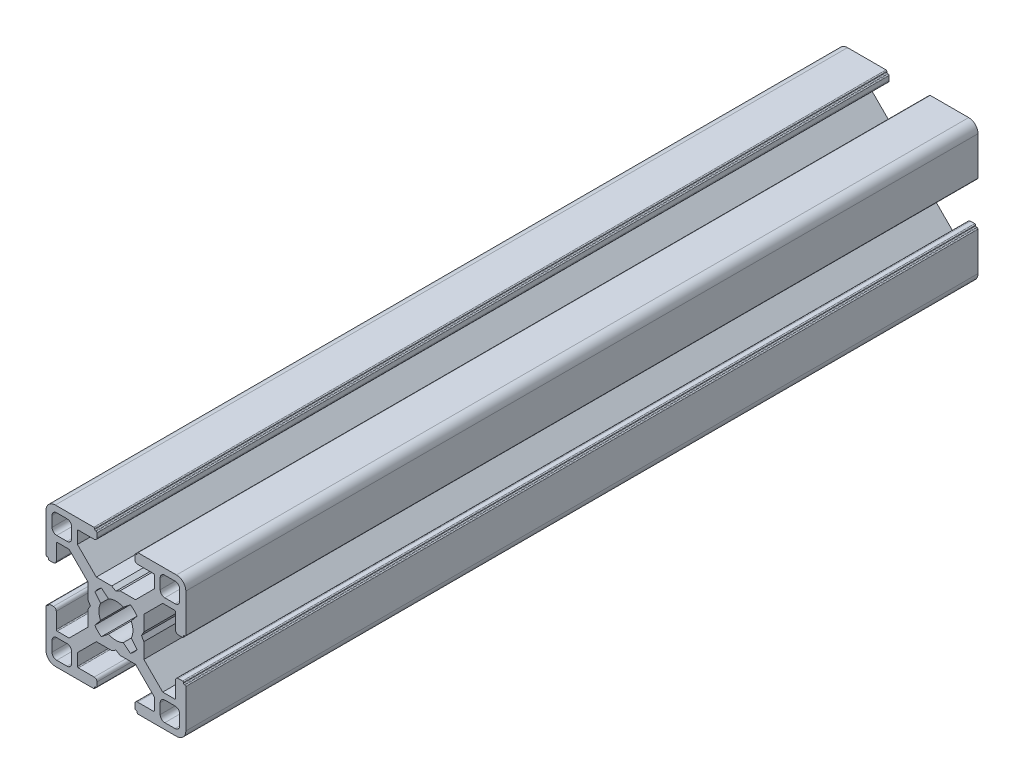
from build123d import *

# Parameters (mm, degrees)
DODANIE_WYCI_GNI_CIE1_DEPTH = 85


with BuildPart() as part:
    # Szkic1 → Dodanie-wyciągnięcie1 (new, symmetric)
    with BuildSketch(Plane.XY):
        with BuildLine():
            Line((0, -5.48), (0.90066642, -6))
            Line((0.90066642, -6), (4.203948776, -6))
            Line((4.203948776, -6), (8.25, -10.046051224))
            Line((8.25, -10.046051224), (8.25, -12.6))
            ThreePointArc((8.25, -12.6), (8.191421356, -12.741421356), (8.05, -12.8))
            Line((8.05, -12.8), (4.65, -12.8))
            ThreePointArc((4.65, -12.8), (4.225735931, -12.975735931), (4.05, -13.4))
            Line((4.05, -13.4), (4.05, -14.3))
            ThreePointArc((4.05, -14.3), (4.108578644, -14.441421356), (4.25, -14.5))
            Line((4.25, -14.5), (4.35, -14.5))
            ThreePointArc((4.35, -14.5), (4.491421356, -14.558578644), (4.55, -14.7))
            Line((4.55, -14.7), (4.55, -14.8))
            ThreePointArc((4.55, -14.8), (4.608578644, -14.941421356), (4.75, -15))
            Line((4.75, -15), (13, -15))
            ThreePointArc((13, -15), (14.414213562, -14.414213562), (15, -13))
            Line((15, -13), (15, -4.75))
            ThreePointArc((15, -4.75), (14.941421356, -4.608578644), (14.8, -4.55))
            Line((14.8, -4.55), (14.7, -4.55))
            ThreePointArc((14.7, -4.55), (14.558578644, -4.491421356), (14.5, -4.35))
            Line((14.5, -4.35), (14.5, -4.25))
            ThreePointArc((14.5, -4.25), (14.441421356, -4.108578644), (14.3, -4.05))
            Line((14.3, -4.05), (13.4, -4.05))
            ThreePointArc((13.4, -4.05), (12.975735931, -4.225735931), (12.8, -4.65))
            Line((12.8, -4.65), (12.8, -8.05))
            ThreePointArc((12.8, -8.05), (12.741421356, -8.191421356), (12.6, -8.25))
            Line((12.6, -8.25), (10.046051224, -8.25))
            Line((10.046051224, -8.25), (6, -4.203948776))
            Line((6, -4.203948776), (6, -0.90066642))
            Line((6, -0.90066642), (5.48, 0))
            Line((5.48, 0), (6, 0.90066642))
            Line((6, 0.90066642), (6, 4.203948776))
            Line((6, 4.203948776), (10.046051224, 8.25))
            Line((10.046051224, 8.25), (12.6, 8.25))
            ThreePointArc((12.6, 8.25), (12.741421356, 8.191421356), (12.8, 8.05))
            Line((12.8, 8.05), (12.8, 4.65))
            ThreePointArc((12.8, 4.65), (12.975735931, 4.225735931), (13.4, 4.05))
            Line((13.4, 4.05), (14.3, 4.05))
            ThreePointArc((14.3, 4.05), (14.441421356, 4.108578644), (14.5, 4.25))
            Line((14.5, 4.25), (14.5, 4.35))
            ThreePointArc((14.5, 4.35), (14.558578644, 4.491421356), (14.7, 4.55))
            Line((14.7, 4.55), (14.8, 4.55))
            ThreePointArc((14.8, 4.55), (14.941421356, 4.608578644), (15, 4.75))
            Line((15, 4.75), (15, 13))
            ThreePointArc((15, 13), (14.414213562, 14.414213562), (13, 15))
            Line((13, 15), (4.75, 15))
            ThreePointArc((4.75, 15), (4.608578644, 14.941421356), (4.55, 14.8))
            Line((4.55, 14.8), (4.55, 14.7))
            ThreePointArc((4.55, 14.7), (4.491421356, 14.558578644), (4.35, 14.5))
            Line((4.35, 14.5), (4.25, 14.5))
            ThreePointArc((4.25, 14.5), (4.108578644, 14.441421356), (4.05, 14.3))
            Line((4.05, 14.3), (4.05, 13.4))
            ThreePointArc((4.05, 13.4), (4.225735931, 12.975735931), (4.65, 12.8))
            Line((4.65, 12.8), (8.05, 12.8))
            ThreePointArc((8.05, 12.8), (8.191421356, 12.741421356), (8.25, 12.6))
            Line((8.25, 12.6), (8.25, 10.046051224))
            Line((8.25, 10.046051224), (4.203948776, 6))
            Line((4.203948776, 6), (0.90066642, 6))
            Line((0.90066642, 6), (0, 5.48))
            Line((0, 5.48), (-0.90066642, 6))
            Line((-0.90066642, 6), (-4.203948776, 6))
            Line((-4.203948776, 6), (-8.25, 10.046051224))
            Line((-8.25, 10.046051224), (-8.25, 12.6))
            ThreePointArc((-8.25, 12.6), (-8.191421356, 12.741421356), (-8.05, 12.8))
            Line((-8.05, 12.8), (-4.65, 12.8))
            ThreePointArc((-4.65, 12.8), (-4.225735931, 12.975735931), (-4.05, 13.4))
            Line((-4.05, 13.4), (-4.05, 14.3))
            ThreePointArc((-4.05, 14.3), (-4.108578644, 14.441421356), (-4.25, 14.5))
            Line((-4.25, 14.5), (-4.35, 14.5))
            ThreePointArc((-4.35, 14.5), (-4.491421356, 14.558578644), (-4.55, 14.7))
            Line((-4.55, 14.7), (-4.55, 14.8))
            ThreePointArc((-4.55, 14.8), (-4.608578644, 14.941421356), (-4.75, 15))
            Line((-4.75, 15), (-13, 15))
            ThreePointArc((-13, 15), (-14.414213562, 14.414213562), (-15, 13))
            Line((-15, 13), (-15, 4.75))
            ThreePointArc((-15, 4.75), (-14.941421356, 4.608578644), (-14.8, 4.55))
            Line((-14.8, 4.55), (-14.7, 4.55))
            ThreePointArc((-14.7, 4.55), (-14.558578644, 4.491421356), (-14.5, 4.35))
            Line((-14.5, 4.35), (-14.5, 4.25))
            ThreePointArc((-14.5, 4.25), (-14.441421356, 4.108578644), (-14.3, 4.05))
            Line((-14.3, 4.05), (-13.4, 4.05))
            ThreePointArc((-13.4, 4.05), (-12.975735931, 4.225735931), (-12.8, 4.65))
            Line((-12.8, 4.65), (-12.8, 8.05))
            ThreePointArc((-12.8, 8.05), (-12.741421356, 8.191421356), (-12.6, 8.25))
            Line((-12.6, 8.25), (-10.046051224, 8.25))
            Line((-10.046051224, 8.25), (-6, 4.203948776))
            Line((-6, 4.203948776), (-6, 0.90066642))
            Line((-6, 0.90066642), (-5.48, 0))
            Line((-5.48, 0), (-6, -0.90066642))
            Line((-6, -0.90066642), (-6, -4.203948776))
            Line((-6, -4.203948776), (-10.046051224, -8.25))
            Line((-10.046051224, -8.25), (-12.6, -8.25))
            ThreePointArc((-12.6, -8.25), (-12.741421356, -8.191421356), (-12.8, -8.05))
            Line((-12.8, -8.05), (-12.8, -4.65))
            ThreePointArc((-12.8, -4.65), (-12.975735931, -4.225735931), (-13.4, -4.05))
            Line((-13.4, -4.05), (-14.3, -4.05))
            ThreePointArc((-14.3, -4.05), (-14.441421356, -4.108578644), (-14.5, -4.25))
            Line((-14.5, -4.25), (-14.5, -4.35))
            ThreePointArc((-14.5, -4.35), (-14.558578644, -4.491421356), (-14.7, -4.55))
            Line((-14.7, -4.55), (-14.8, -4.55))
            ThreePointArc((-14.8, -4.55), (-14.941421356, -4.608578644), (-15, -4.75))
            Line((-15, -4.75), (-15, -13))
            ThreePointArc((-15, -13), (-14.414213562, -14.414213562), (-13, -15))
            Line((-13, -15), (-4.75, -15))
            ThreePointArc((-4.75, -15), (-4.608578644, -14.941421356), (-4.55, -14.8))
            Line((-4.55, -14.8), (-4.55, -14.7))
            ThreePointArc((-4.55, -14.7), (-4.491421356, -14.558578644), (-4.35, -14.5))
            Line((-4.35, -14.5), (-4.25, -14.5))
            ThreePointArc((-4.25, -14.5), (-4.108578644, -14.441421356), (-4.05, -14.3))
            Line((-4.05, -14.3), (-4.05, -13.4))
            ThreePointArc((-4.05, -13.4), (-4.225735931, -12.975735931), (-4.65, -12.8))
            Line((-4.65, -12.8), (-8.05, -12.8))
            ThreePointArc((-8.05, -12.8), (-8.191421356, -12.741421356), (-8.25, -12.6))
            Line((-8.25, -12.6), (-8.25, -10.046051224))
            Line((-8.25, -10.046051224), (-4.203948776, -6))
            Line((-4.203948776, -6), (-0.90066642, -6))
            Line((-0.90066642, -6), (0, -5.48))
        make_face()
        with BuildLine():
            Line((12.7, 13.7), (10.5, 13.7))
            ThreePointArc((10.5, 13.7), (9.792893219, 13.407106781), (9.5, 12.7))
            Line((9.5, 12.7), (9.5, 10.5))
            ThreePointArc((9.5, 10.5), (9.792893219, 9.792893219), (10.5, 9.5))
            Line((10.5, 9.5), (12.7, 9.5))
            ThreePointArc((12.7, 9.5), (13.407106781, 9.792893219), (13.7, 10.5))
            Line((13.7, 10.5), (13.7, 12.7))
            ThreePointArc((13.7, 12.7), (13.407106781, 13.407106781), (12.7, 13.7))
        make_face(mode=Mode.SUBTRACT)
        with BuildLine():
            Line((-1.58286583, 3.288926233), (-3.117157854, 4.531371416))
            ThreePointArc((-3.117157854, 4.531371416), (-3.889087297, 3.889087297), (-4.531371416, 3.117157854))
            Line((-4.531371416, 3.117157854), (-3.288926233, 1.58286583))
            ThreePointArc((-3.288926233, 1.58286583), (-3.65, 0), (-3.288926233, -1.58286583))
            Line((-3.288926233, -1.58286583), (-4.531371416, -3.117157854))
            ThreePointArc((-4.531371416, -3.117157854), (-3.889087297, -3.889087297), (-3.117157854, -4.531371416))
            Line((-3.117157854, -4.531371416), (-1.58286583, -3.288926233))
            ThreePointArc((-1.58286583, -3.288926233), (0, -3.65), (1.58286583, -3.288926233))
            Line((1.58286583, -3.288926233), (3.117157854, -4.531371416))
            ThreePointArc((3.117157854, -4.531371416), (3.889087297, -3.889087297), (4.531371416, -3.117157854))
            Line((4.531371416, -3.117157854), (3.288926233, -1.58286583))
            ThreePointArc((3.288926233, -1.58286583), (3.65, 0), (3.288926233, 1.58286583))
            Line((3.288926233, 1.58286583), (4.531371416, 3.117157854))
            ThreePointArc((4.531371416, 3.117157854), (3.889087297, 3.889087297), (3.117157854, 4.531371416))
            Line((3.117157854, 4.531371416), (1.58286583, 3.288926233))
            ThreePointArc((1.58286583, 3.288926233), (0, 3.65), (-1.58286583, 3.288926233))
        make_face(mode=Mode.SUBTRACT)
        with BuildLine():
            Line((-12.7, -13.7), (-10.5, -13.7))
            ThreePointArc((-10.5, -13.7), (-9.792893219, -13.407106781), (-9.5, -12.7))
            Line((-9.5, -12.7), (-9.5, -10.5))
            ThreePointArc((-9.5, -10.5), (-9.792893219, -9.792893219), (-10.5, -9.5))
            Line((-10.5, -9.5), (-12.7, -9.5))
            ThreePointArc((-12.7, -9.5), (-13.407106781, -9.792893219), (-13.7, -10.5))
            Line((-13.7, -10.5), (-13.7, -12.7))
            ThreePointArc((-13.7, -12.7), (-13.407106781, -13.407106781), (-12.7, -13.7))
        make_face(mode=Mode.SUBTRACT)
        with BuildLine():
            Line((13.7, -12.7), (13.7, -10.5))
            ThreePointArc((13.7, -10.5), (13.407106781, -9.792893219), (12.7, -9.5))
            Line((12.7, -9.5), (10.5, -9.5))
            ThreePointArc((10.5, -9.5), (9.792893219, -9.792893219), (9.5, -10.5))
            Line((9.5, -10.5), (9.5, -12.7))
            ThreePointArc((9.5, -12.7), (9.792893219, -13.407106781), (10.5, -13.7))
            Line((10.5, -13.7), (12.7, -13.7))
            ThreePointArc((12.7, -13.7), (13.407106781, -13.407106781), (13.7, -12.7))
        make_face(mode=Mode.SUBTRACT)
        with BuildLine():
            Line((-10.5, 13.7), (-12.7, 13.7))
            ThreePointArc((-12.7, 13.7), (-13.407106781, 13.407106781), (-13.7, 12.7))
            Line((-13.7, 12.7), (-13.7, 10.5))
            ThreePointArc((-13.7, 10.5), (-13.407106781, 9.792893219), (-12.7, 9.5))
            Line((-12.7, 9.5), (-10.5, 9.5))
            ThreePointArc((-10.5, 9.5), (-9.792893219, 9.792893219), (-9.5, 10.5))
            Line((-9.5, 10.5), (-9.5, 12.7))
            ThreePointArc((-9.5, 12.7), (-9.792893219, 13.407106781), (-10.5, 13.7))
        make_face(mode=Mode.SUBTRACT)
    extrude(amount=DODANIE_WYCI_GNI_CIE1_DEPTH, both=True)


solid = part.part
